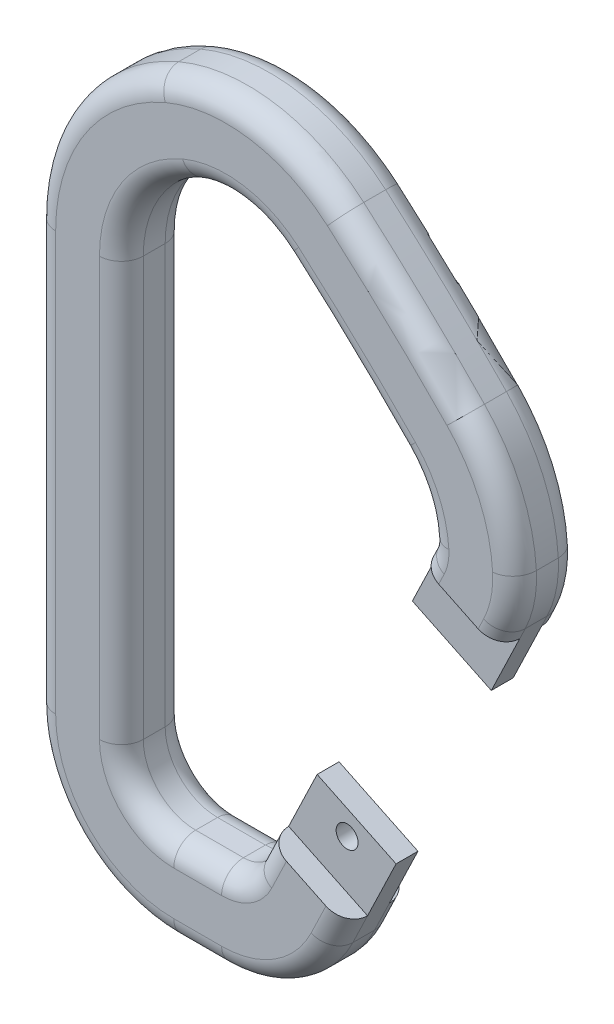
from build123d import *

# Parameters (mm, degrees)
BOSS_EXTRUDE1_DEPTH     = 7.62
FILLET1_R               = 2.54
SKETCH4_W               = 10.16
SKETCH4_H               = 2.54
BOSS_EXTRUDE2_DEPTH     = 40.698655059
CUT_EXTRUDE1_DEPTH      = 92.035139481
CUT_EXTRUDE1_DEPTH_BACK = 92.035139481
SKETCH7_R               = 1.27
CUT_EXTRUDE2_DEPTH      = 92.212140759


with BuildPart() as part:
    # Sketch2 → Boss-Extrude1 (new body)
    with BuildSketch(Plane.XY):
        with BuildLine():
            Line((557.368573337, 914.592873905), (556.734884655, 913.276848696))
            Line((556.734884655, 913.276848696), (547.580835245, 917.684680294))
            Line((547.580835245, 917.684680294), (548.214523926, 919.000705503))
            ThreePointArc((548.214523926, 919.000705503), (548.458818056, 919.731374997), (548.513066645, 920.499889552))
            ThreePointArc((548.513066645, 920.499889552), (547.585939227, 924.379743345), (545.358485968, 927.689015574))
            ThreePointArc((545.358485968, 927.689015574), (538.788952643, 934.173311823), (531.958551893, 940.382216038))
            ThreePointArc((531.958551893, 940.382216038), (526.80512603, 942.791823737), (521.15870091, 942.097640216))
            ThreePointArc((521.15870091, 942.097640216), (515.269866914, 937.194322522), (513.062812413, 929.85608018))
            Line((513.062812413, 929.85608018), (513.062812413, 881.310664403))
            ThreePointArc((513.062812413, 881.310664403), (514.84238247, 877.01697918), (519.13757646, 875.241053792))
            Line((519.13757646, 875.241053792), (524.686345009, 875.245763006))
            ThreePointArc((524.686345009, 875.245763006), (526.769666342, 875.847420281), (528.214212618, 877.464672677))
            Line((528.214212618, 877.464672677), (529.924061844, 881.015635083))
            Line((529.924061844, 881.015635083), (539.078111254, 876.607803485))
            Line((539.078111254, 876.607803485), (537.368262028, 873.056841079))
            ThreePointArc((537.368262028, 873.056841079), (532.178962974, 867.247123196), (524.69496775, 865.085766665))
            Line((524.69496775, 865.085766665), (519.146199201, 865.081057451))
            ThreePointArc((519.146199201, 865.081057451), (507.66122682, 869.82972633), (502.902812413, 881.310664403))
            Line((502.902812413, 881.310664403), (502.902812413, 929.85608018))
            ThreePointArc((502.902812413, 929.85608018), (506.79547726, 942.798813577), (517.181834766, 951.446978999))
            ThreePointArc((517.181834766, 951.446978999), (528.398937465, 952.826033478), (538.636655301, 948.039143286))
            ThreePointArc((538.636655301, 948.039143286), (545.776010677, 941.549396152), (552.642698999, 934.771800374))
            ThreePointArc((552.642698999, 934.771800374), (556.88965456, 928.462203511), (558.657354478, 921.064711969))
            ThreePointArc((558.657354478, 921.064711969), (558.423168364, 917.747106133), (557.368573337, 914.592873905))
        make_face()
    extrude(amount=BOSS_EXTRUDE1_DEPTH)


with BuildPart() as part_1:
    # Body-Move/Copy1: moved
    add(part.part.moved(Location((-502.902812413, -881.310664403, 0))))

    # Fillet1
    fillet1_edges = [part_1.edges().sort_by_distance(p)[0] for p in [
        (42.873198264, 60.238731749, 7.62),
        (53.986842147, 47.151539108, 7.62),
        (55.520355951, 36.43644173, 7.62),
        (54.148916583, 32.624196898, 7.62),
        (0, 24.272707889, 0),
        (4.758414407, -11.480938073, 0),
        (19.017771063, -16.227252345, 0),
        (29.276150561, -14.063541207, 0),
        (35.320374228, -6.478342121, 0),
        (26.166324818, -2.070510523, 0),
        (23.86685393, -5.463244122, 0),
        (19.009148321, -6.067256004, 0),
        (11.939570057, -4.293685223, 0),
        (10.16, 24.272707889, 0),
        (12.367054501, 55.883658119, 0),
        (44.994867173, 37.032028495, 7.62),
        (23.902313617, 61.481159334, 0),
        (35.88614023, 52.86264742, 0),
        (44.683126814, 43.069078942, 0),
        (45.556005643, 38.420710594, 0),
        (44.994867173, 37.032028495, 0),
        (54.148916583, 32.624196898, 0),
        (45.556005643, 38.420710594, 7.62),
        (55.520355951, 36.43644173, 0),
        (53.986842147, 47.151539108, 0),
        (42.873198264, 60.238731749, 0),
        (25.496125052, 71.515369074, 0),
        (3.892664847, 61.488149174, 0),
        (44.683126814, 43.069078942, 7.62),
        (35.88614023, 52.86264742, 7.62),
        (23.902313617, 61.481159334, 7.62),
        (3.892664847, 61.488149174, 7.62),
        (12.367054501, 55.883658119, 7.62),
        (10.16, 24.272707889, 7.62),
        (11.939570057, -4.293685223, 7.62),
        (19.009148321, -6.067256004, 7.62),
        (23.86685393, -5.463244122, 7.62),
        (26.166324818, -2.070510523, 7.62),
        (35.320374228, -6.478342121, 7.62),
        (29.276150561, -14.063541207, 7.62),
        (19.017771063, -16.227252345, 7.62),
        (25.496125052, 71.515369074, 7.62),
        (4.758414407, -11.480938073, 7.62),
        (0, 24.272707889, 7.62),
    ]]
    fillet(fillet1_edges, radius=FILLET1_R)

    # Sketch4 → Boss-Extrude2 (add)
    with BuildSketch(Plane(origin=(22.627352506, 46.991791376, 0), x_dir=(0.9009891151809732, -0.433841692700698, 0), z_dir=(-0.43384169270069806, -0.9009891151809734, 0))):
        with Locations((29.553847635, 3.81)):
            Rectangle(SKETCH4_W, SKETCH4_H)
    extrude(amount=BOSS_EXTRUDE2_DEPTH)

    # Sketch5 → Cut-Extrude1 (cut, two sides: drawn at the far end of the back side and taken through both)
    with BuildSketch(Plane.XY.offset(5.08).offset(-CUT_EXTRUDE1_DEPTH_BACK)):
        Polygon((41.372149134, 29.508478833), (50.526198544, 25.100647236), (39.48117254, 2.16267614), (30.327123129, 6.570507738), align=None)
    extrude(amount=CUT_EXTRUDE1_DEPTH + CUT_EXTRUDE1_DEPTH_BACK, mode=Mode.SUBTRACT)

    # Sketch7 → Cut-Extrude2 (cut, through all)
    with BuildSketch(Plane.XY):
        with Locations(Location((33.802189935, 2.078079586, 0), (0, 0, 180))):
            Circle(SKETCH7_R)
    extrude(amount=CUT_EXTRUDE2_DEPTH, mode=Mode.SUBTRACT)


solid = part_1.part
